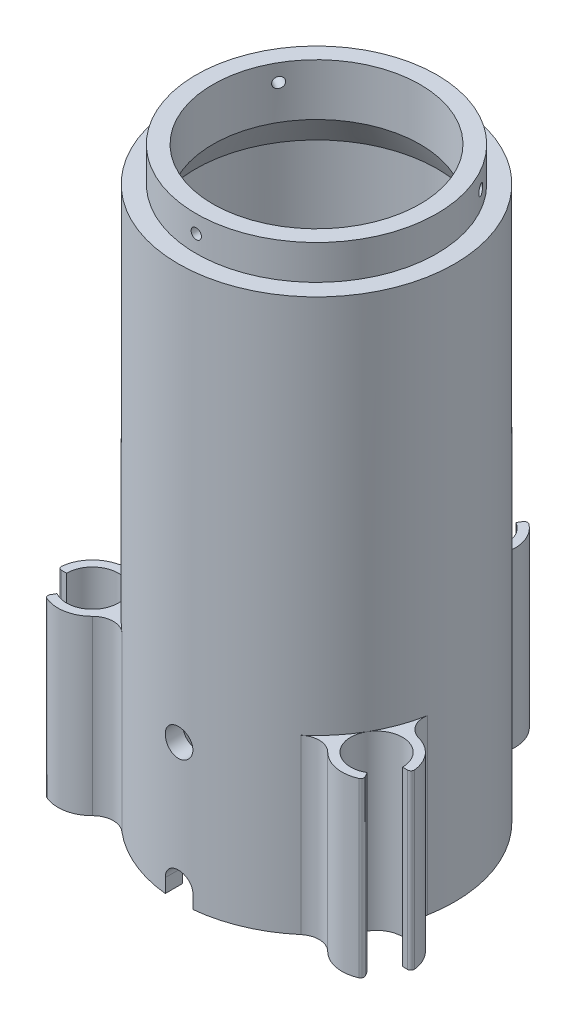
from build123d import *

# Parameters (mm, degrees)
SKETCH1_R               = 40
SKETCH1_R_2             = 35
BOSS_EXTRUDE1_DEPTH     = 180
BOSS_EXTRUDE2_DEPTH     = 50
SKETCH6_R               = 5.5
BOSS_EXTRUDE3_DEPTH     = 8
CUT_EXTRUDE1_REACH      = 154.121
SKETCH7_R               = 1.55
CUT_EXTRUDE2_START      = -50
SKETCH9_R               = 40
CUT_EXTRUDE2_DEPTH      = 50
CUT_EXTRUDE3_REACH      = 203.684
CUT_EXTRUDE3_END_RADIUS = 30
SKETCH11_R              = 1.5
CIRPATTERN1_COUNT       = 3
CUT_EXTRUDE4_REACH      = 203.684
CUT_EXTRUDE4_END_RADIUS = 35
SKETCH12_R              = 4


with BuildPart() as part:
    # Sketch1 → Boss-Extrude1 (new body)
    with BuildSketch(Plane(origin=(0, 0, 0), x_dir=(1, 0, 0), z_dir=(0, 1, 0))):
        with Locations(Location((0, 0, 0), (0, 0, 90))):
            Circle(SKETCH1_R)
        with Locations(Location((0, 0, 0), (0, 0, 90))):
            Circle(SKETCH1_R_2, mode=Mode.SUBTRACT)
    extrude(amount=BOSS_EXTRUDE1_DEPTH)

    # Sketch3 → Revolve1 (revolve)
    with BuildSketch(Plane(origin=(0, 0, 0), x_dir=(0, 0, -1), z_dir=(1, 0, 0)), mode=Mode.PRIVATE) as revolve1_sk:
        with BuildLine():
            Line((-35, 180), (-40, 180))
            Line((-40, 180), (-40, 185))
            add(Edge.make_bspline(
                [(-20, 210), (-35.448934618, 201.981430701), (-40, 185)],
                knots=[0, 0, 0, 1, 1, 1], degree=2))
            Line((-20, 210), (0, 210))
            Line((0, 210), (0, 202.928932188))
            Line((0, 202.928932188), (-20, 202.928932188))
            add(Edge.make_bspline(
                [(-20, 202.928932188), (-32.989454859, 194.577869332), (-35, 180)],
                knots=[0, 0, 0, 1, 1, 1], degree=2))
        make_face()
    revolve(revolve1_sk.sketch.rotate(Axis((0, -20.154872571, 0), (0, 1, 0)), 180), axis=Axis((0, -20.154872571, 0), (0, 1, 0)))

    # Sketch4 → Boss-Extrude2 (add)
    with BuildSketch(Plane(origin=(0, 0, 0), x_dir=(1, 0, 0), z_dir=(0, 1, 0))):
        with BuildLine():
            Line((4.472135955, 55.245966692), (3.75, 53.995190528))
            ThreePointArc((3.75, 53.995190528), (0, 40), (-3.75, 53.995190528))
            Line((-3.75, 53.995190528), (-4.472135955, 55.245966692))
            ThreePointArc((-4.472135955, 55.245966692), (-5.133489086, 55.72479725), (-5.931290399, 55.551074103))
            ThreePointArc((-5.931290399, 55.551074103), (-9.440614698, 50.797695275), (-9.654223492, 44.893092105))
            ThreePointArc((-9.654223492, 44.893092105), (-10.13118194, 40.546025245), (-13.431963119, 37.677345538))
            Line((-13.431963119, 37.677345538), (13.431963119, 37.677345538))
            ThreePointArc((13.431963119, 37.677345538), (10.13118194, 40.546025245), (9.654223492, 44.893092105))
            ThreePointArc((9.654223492, 44.893092105), (9.440614698, 50.797695275), (5.931290399, 55.551074103))
            ThreePointArc((5.931290399, 55.551074103), (5.133489086, 55.72479725), (4.472135955, 55.245966692))
        make_face()
        with BuildLine():
            Line((45.608342635, -31.495966692), (44.88620668, -30.245190528))
            ThreePointArc((44.88620668, -30.245190528), (34.641016151, -20), (48.63620668, -23.75))
            Line((48.63620668, -23.75), (50.08047859, -23.75))
            ThreePointArc((50.08047859, -23.75), (50.825834582, -23.416666667), (51.07428658, -22.638888889))
            ThreePointArc((51.07428658, -22.638888889), (48.712401911, -17.223035482), (43.705669963, -14.085743255))
            ThreePointArc((43.705669963, -14.085743255), (40.179478855, -11.499151692), (39.345519942, -7.206251485))
            Line((39.345519942, -7.206251485), (25.913556823, -30.471094053))
            ThreePointArc((25.913556823, -30.471094053), (30.048296914, -29.046873553), (34.051446472, -30.80734885))
            ThreePointArc((34.051446472, -30.80734885), (39.271787213, -33.574659793), (45.142996181, -32.912185214))
            ThreePointArc((45.142996181, -32.912185214), (45.692345496, -32.308130583), (45.608342635, -31.495966692))
        make_face()
        with BuildLine():
            Line((-50.08047859, -23.75), (-48.63620668, -23.75))
            ThreePointArc((-48.63620668, -23.75), (-34.641016151, -20), (-44.88620668, -30.245190528))
            Line((-44.88620668, -30.245190528), (-45.608342635, -31.495966692))
            ThreePointArc((-45.608342635, -31.495966692), (-45.692345496, -32.308130583), (-45.142996181, -32.912185214))
            ThreePointArc((-45.142996181, -32.912185214), (-39.271787213, -33.574659793), (-34.051446472, -30.80734885))
            ThreePointArc((-34.051446472, -30.80734885), (-30.048296914, -29.046873553), (-25.913556823, -30.471094053))
            Line((-25.913556823, -30.471094053), (-39.345519942, -7.206251485))
            ThreePointArc((-39.345519942, -7.206251485), (-40.179478855, -11.499151692), (-43.705669963, -14.085743255))
            ThreePointArc((-43.705669963, -14.085743255), (-48.712401911, -17.223035482), (-51.07428658, -22.638888889))
            ThreePointArc((-51.07428658, -22.638888889), (-50.825834582, -23.416666667), (-50.08047859, -23.75))
        make_face()
    extrude(amount=BOSS_EXTRUDE2_DEPTH)

    # Sketch6 → Boss-Extrude3 (add)
    with BuildSketch(Plane(origin=(0, 70, 0), x_dir=(1, 0, 0), z_dir=(0, 1, 0))):
        with BuildLine():
            Line((-5, 34.641016151), (-5, 11.456439237))
            ThreePointArc((-5, 11.456439237), (-10.458250332, 6.846531969), (-12.5, 0))
            Line((-12.5, 0), (-32.948700726, -11.806062869))
            ThreePointArc((-32.948700726, -11.806062869), (-30.310889132, -17.5), (-26.698700726, -22.631380416))
            Line((-26.698700726, -22.631380416), (-6.25, -10.825317547))
            ThreePointArc((-6.25, -10.825317547), (0, -12.5), (6.25, -10.825317547))
            Line((6.25, -10.825317547), (26.698700726, -22.631380416))
            ThreePointArc((26.698700726, -22.631380416), (30.310889132, -17.5), (32.948700726, -11.806062869))
            Line((32.948700726, -11.806062869), (12.5, 0))
            ThreePointArc((12.5, 0), (10.458250332, 6.846531969), (5, 11.456439237))
            Line((5, 11.456439237), (5, 34.641016151))
            ThreePointArc((5, 34.641016151), (0, 35), (-5, 34.641016151))
        make_face()
        with Locations(Location((0, 0, 0), (0, 0, 270))):
            Circle(SKETCH6_R, mode=Mode.SUBTRACT)
    extrude(amount=BOSS_EXTRUDE3_DEPTH)

    # Sketch7 → Cut-Extrude1 (cut, up to next)
    with BuildSketch(Plane(origin=(0, 78, 0), x_dir=(1, 0, 0), z_dir=(0, 1, 0)), mode=Mode.PRIVATE) as cut_extrude1_sk1:
        with Locations(Location((0, 8, 0), (0, 0, 270))):
            Circle(SKETCH7_R)
    cut_extrude1_tool1 = extrude(cut_extrude1_sk1.sketch, amount=-CUT_EXTRUDE1_REACH, mode=Mode.PRIVATE) & part.part
    # Sketch7 → Cut-Extrude1 (cut, up to next)
    with BuildSketch(Plane(origin=(0, 78, 0), x_dir=(1, 0, 0), z_dir=(0, 1, 0)), mode=Mode.PRIVATE) as cut_extrude1_sk2:
        with Locations(Location((8, 0, 0), (0, 0, 270))):
            Circle(SKETCH7_R)
    cut_extrude1_tool2 = extrude(cut_extrude1_sk2.sketch, amount=-CUT_EXTRUDE1_REACH, mode=Mode.PRIVATE) & part.part
    # Sketch7 → Cut-Extrude1 (cut, up to next)
    with BuildSketch(Plane(origin=(0, 78, 0), x_dir=(1, 0, 0), z_dir=(0, 1, 0)), mode=Mode.PRIVATE) as cut_extrude1_sk3:
        with Locations(Location((0, -8, 0), (0, 0, 270))):
            Circle(SKETCH7_R)
    cut_extrude1_tool3 = extrude(cut_extrude1_sk3.sketch, amount=-CUT_EXTRUDE1_REACH, mode=Mode.PRIVATE) & part.part
    # Sketch7 → Cut-Extrude1 (cut, up to next)
    with BuildSketch(Plane(origin=(0, 78, 0), x_dir=(1, 0, 0), z_dir=(0, 1, 0)), mode=Mode.PRIVATE) as cut_extrude1_sk4:
        with Locations(Location((-8, 0, 0), (0, 0, 270))):
            Circle(SKETCH7_R)
    cut_extrude1_tool4 = extrude(cut_extrude1_sk4.sketch, amount=-CUT_EXTRUDE1_REACH, mode=Mode.PRIVATE) & part.part
    add(cut_extrude1_tool1.solids().sort_by_distance((0, 78, -8))[0], mode=Mode.SUBTRACT)
    add(cut_extrude1_tool2.solids().sort_by_distance((8, 78, 0))[0], mode=Mode.SUBTRACT)
    add(cut_extrude1_tool3.solids().sort_by_distance((0, 78, 8))[0], mode=Mode.SUBTRACT)
    add(cut_extrude1_tool4.solids().sort_by_distance((-8, 78, 0))[0], mode=Mode.SUBTRACT)

    # Sketch9 → Cut-Extrude2 (cut)
    with BuildSketch(Plane(origin=(0, 210, 0), x_dir=(1, 0, 0), z_dir=(0, 1, 0)).offset(CUT_EXTRUDE2_START)):
        with Locations(Location((0, 0, 0), (0, 0, 90))):
            Circle(SKETCH9_R)
    extrude(amount=CUT_EXTRUDE2_DEPTH, mode=Mode.SUBTRACT)

    # Sketch10 → Revolve2 (revolve)
    with BuildSketch(Plane.XY, mode=Mode.PRIVATE) as revolve2_sk:
        Polygon((-35, 146.339745962), (-30, 155), (-30, 170), (-34.85, 170), (-34.85, 160), (-35, 160), align=None)
    revolve(revolve2_sk.sketch.rotate(Axis((0, 0, 0), (0, 1, 0)), 270), axis=Axis((0, 0, 0), (0, 1, 0)))

    # Cut-Extrude3: up to this cylinder (the profile starts outside it)
    cut_extrude3_end = Plane(origin=(0, 165, 0), z_dir=(0, -1, 0)) * Cylinder(CUT_EXTRUDE3_END_RADIUS, 468.368, mode=Mode.PRIVATE)
    # Sketch11 → Cut-Extrude3 (cut, up to the surface)
    with BuildSketch(Plane.XY.offset(40), mode=Mode.PRIVATE) as cut_extrude3_sk1:
        with Locations((0, 165)):
            Circle(SKETCH11_R)
    cut_extrude3_tool1 = extrude(cut_extrude3_sk1.sketch, amount=-CUT_EXTRUDE3_REACH, mode=Mode.PRIVATE) - cut_extrude3_end
    cut_extrude3 = cut_extrude3_tool1.solids().sort_by_distance((0, 165, 40))[0]
    add(cut_extrude3, mode=Mode.SUBTRACT)

    # CirPattern1: Cut-Extrude3 ×3 about axis
    cirpattern1_axis = Axis((0, 170, 0), (0, -1, 0))
    for i in range(1, CIRPATTERN1_COUNT):
        add(cut_extrude3.rotate(cirpattern1_axis, i * 360 / CIRPATTERN1_COUNT), mode=Mode.SUBTRACT)

    # Cut-Extrude4: up to this cylinder (the profile starts outside it)
    cut_extrude4_end = Plane(origin=(0, 21.8133005, 0), z_dir=(0, -1, 0)) * Cylinder(CUT_EXTRUDE4_END_RADIUS, 514.741399, mode=Mode.PRIVATE)
    # Sketch12 → Cut-Extrude4 (cut, up to the surface)
    with BuildSketch(Plane.XY.offset(40), mode=Mode.PRIVATE) as cut_extrude4_sk1:
        with Locations((0, 40)):
            Circle(SKETCH12_R)
    cut_extrude4_tool1 = extrude(cut_extrude4_sk1.sketch, amount=-CUT_EXTRUDE4_REACH, mode=Mode.PRIVATE) - cut_extrude4_end
    add(cut_extrude4_tool1.solids().sort_by_distance((0, 40, 40))[0], mode=Mode.SUBTRACT)
    # Sketch12 → Cut-Extrude4 (cut, up to the surface)
    with BuildSketch(Plane.XY.offset(40), mode=Mode.PRIVATE) as cut_extrude4_sk2:
        with BuildLine():
            Line((-4, 0), (4, 0))
            Line((4, 0), (4, 4))
            ThreePointArc((4, 4), (0, 8), (-4, 4))
            Line((-4, 4), (-4, 0))
        make_face()
    cut_extrude4_tool2 = extrude(cut_extrude4_sk2.sketch, amount=-CUT_EXTRUDE4_REACH, mode=Mode.PRIVATE) - cut_extrude4_end
    add(cut_extrude4_tool2.solids().sort_by_distance((0, 3.626601, 40))[0], mode=Mode.SUBTRACT)


solid = part.part
